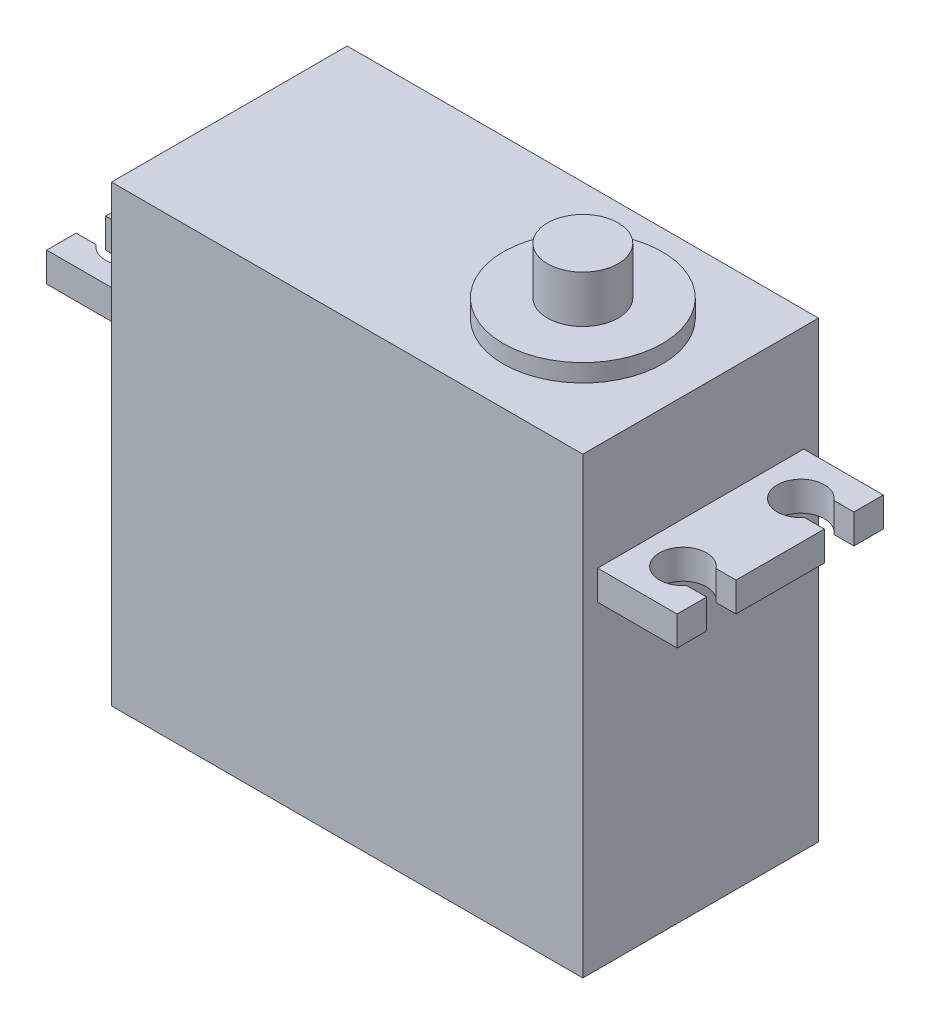
from build123d import *

# Parameters (mm, degrees)
EXTRUDE_1_DEPTH   = 2.5
EXTRUDE_1_2_DEPTH = 2.5
EXTRUDE_4_DEPTH   = 27
EXTRUDE_5_DEPTH   = 11.5
SKETCH_2_R        = 3
EXTRUDE_6_DEPTH   = 5.5
SKETCH_2_3_R      = 6.75
SKETCH_2_3_R_2    = 3
EXTRUDE_7_DEPTH   = 1.5


with BuildPart() as part:
    # Эскиз1 → Бобышка-Вытянуть1 (new body)
    with BuildSketch(Plane(origin=(0, 0, 0), x_dir=(1, 0, 0), z_dir=(0, 1, 0))):
        with BuildLine():
            Line((-20, -8.75), (-20, 8.75))
            Line((-20, 8.75), (-26.75, 8.75))
            Line((-26.75, 8.75), (-26.75, 6.25))
            Line((-26.75, 6.25), (-25.0612495, 6.25))
            ThreePointArc((-25.0612495, 6.25), (-21.5, 5), (-25.0612495, 3.75))
            Line((-25.0612495, 3.75), (-26.75, 3.75))
            Line((-26.75, 3.75), (-26.75, -3.75))
            Line((-26.75, -3.75), (-25.0612495, -3.75))
            ThreePointArc((-25.0612495, -3.75), (-21.5, -5), (-25.0612495, -6.25))
            Line((-25.0612495, -6.25), (-26.75, -6.25))
            Line((-26.75, -6.25), (-26.75, -8.75))
            Line((-26.75, -8.75), (-20, -8.75))
        make_face()
    extrude(amount=EXTRUDE_1_DEPTH)



with BuildPart() as body_2:
    # Эскиз1 → Extrude 1 2 (new body)
    with BuildSketch(Plane(origin=(0, 0, 0), x_dir=(1, 0, 0), z_dir=(0, 1, 0))):
        with BuildLine():
            Line((26.75, 8.75), (20, 8.75))
            Line((20, 8.75), (20, -8.75))
            Line((20, -8.75), (26.75, -8.75))
            Line((26.75, -8.75), (26.75, -6.25))
            Line((26.75, -6.25), (25.0612495, -6.25))
            ThreePointArc((25.0612495, -6.25), (21.5, -5), (25.0612495, -3.75))
            Line((25.0612495, -3.75), (26.75, -3.75))
            Line((26.75, -3.75), (26.75, 3.75))
            Line((26.75, 3.75), (25.0612495, 3.75))
            ThreePointArc((25.0612495, 3.75), (21.5, 5), (25.0612495, 6.25))
            Line((25.0612495, 6.25), (26.75, 6.25))
            Line((26.75, 6.25), (26.75, 8.75))
        make_face()
    extrude(amount=EXTRUDE_1_2_DEPTH)


with BuildPart() as body_3:
    # Эскиз1<7> → Бобышка-Вытянуть4 (new body)
    with BuildSketch(Plane(origin=(0, 0, 0), x_dir=(1, 0, 0), z_dir=(0, 1, 0))):
        Polygon((20, 10), (-20, 10), (-20, 8.75), (-20, -8.75), (-20, -10), (20, -10), (20, -8.75), (20, 8.75), align=None)
    extrude(amount=-EXTRUDE_4_DEPTH)


with BuildPart() as part_1:
    add(part.part)

    add(body_2.part)  # Бобышка-Вытянуть5 merges body 2

    add(body_3.part)  # Бобышка-Вытянуть5 merges body 3
    # Эскиз1<8> → Бобышка-Вытянуть5 (add)
    with BuildSketch(Plane(origin=(0, 0, 0), x_dir=(1, 0, 0), z_dir=(0, 1, 0))):
        Polygon((20, 10), (-20, 10), (-20, 8.75), (-20, -8.75), (-20, -10), (20, -10), (20, -8.75), (20, 8.75), align=None)
    extrude(amount=EXTRUDE_5_DEPTH)

    # Эскиз2 → Бобышка-Вытянуть6 (add)
    with BuildSketch(Plane(origin=(0, 11.5, 0), x_dir=(1, 0, 0), z_dir=(0, 1, 0))):
        with Locations((10, 0)):
            Circle(SKETCH_2_R)
    extrude(amount=EXTRUDE_6_DEPTH)

    # Эскиз2<3> → Бобышка-Вытянуть7 (add)
    with BuildSketch(Plane(origin=(0, 11.5, 0), x_dir=(1, 0, 0), z_dir=(0, 1, 0))):
        with Locations((10, 0)):
            Circle(SKETCH_2_3_R)
        with Locations((10, 0)):
            Circle(SKETCH_2_3_R_2, mode=Mode.SUBTRACT)
    extrude(amount=EXTRUDE_7_DEPTH)


solid = part_1.part
